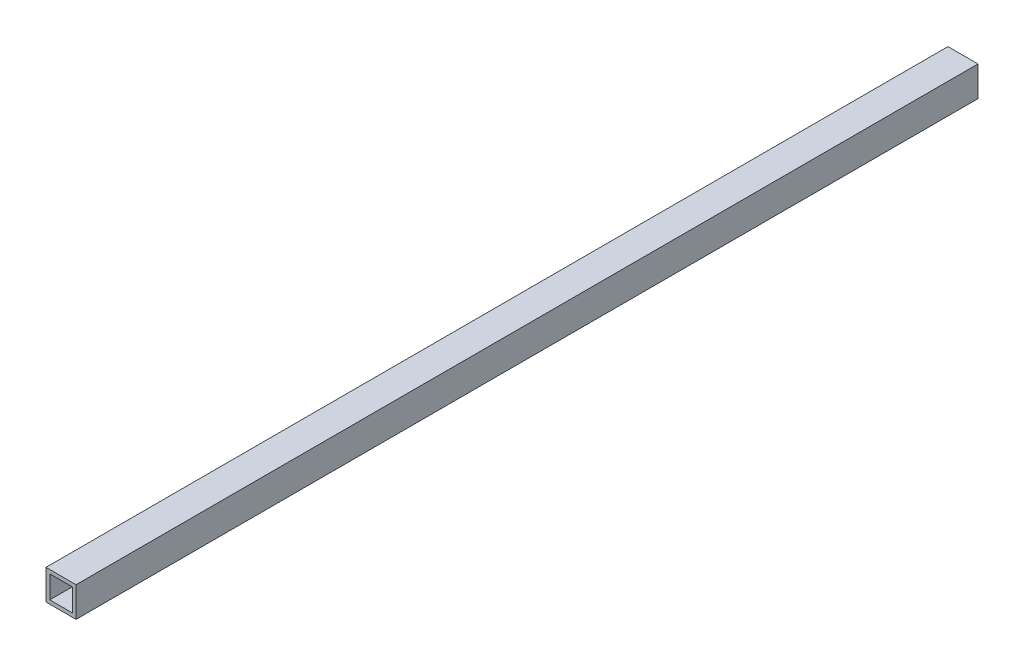
from build123d import *

# Parameters (mm, degrees)
SKETCH1_W           = 25.4
SKETCH1_H           = 25.4
SKETCH1_W_2         = 19.05
SKETCH1_H_2         = 19.05
BOSS_EXTRUDE1_DEPTH = 762


with BuildPart() as part:
    # Sketch1 → Boss-Extrude1 (new body)
    with BuildSketch(Plane.XY):
        with Locations((12.7, 12.7)):
            Rectangle(SKETCH1_W, SKETCH1_H)
        with Locations((12.7, 12.7)):
            Rectangle(SKETCH1_W_2, SKETCH1_H_2, mode=Mode.SUBTRACT)
    extrude(amount=BOSS_EXTRUDE1_DEPTH)


solid = part.part
